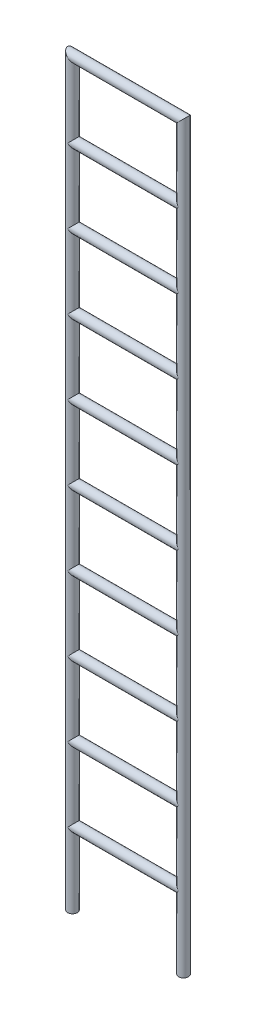
from build123d import *
from build123d.topology import SkipClean

# Parameters (mm, degrees)
SWEEP1_PROFILE_R = 20
LPATTERN1_COUNT  = 10
LPATTERN1_PITCH  = 304.8


with BuildPart() as part:
    # Sweep1: sweep along a path in Sketch3
    with BuildLine(Plane.XY) as sweep1_path:
        Line((0, 0), (0, 304.8))
        Line((0, 304.8), (457.2, 304.8))
        Line((457.2, 304.8), (457.2, 0))
    # Sweep1 profile (on start of the path) → Sweep1 (sweep)
    with BuildSketch(Plane.ZX):
        Circle(SWEEP1_PROFILE_R)
    sweep1 = sweep(path=sweep1_path.line, transition=Transition.RIGHT)

    # LPattern1: Sweep1 ×10
    with SkipClean():  # the faces are left unmerged after this step: merging them gives an invalid solid
        with Locations(*[(0, i * LPATTERN1_PITCH, 0) for i in range(1, LPATTERN1_COUNT)]):
            add(sweep1)


solid = part.part
